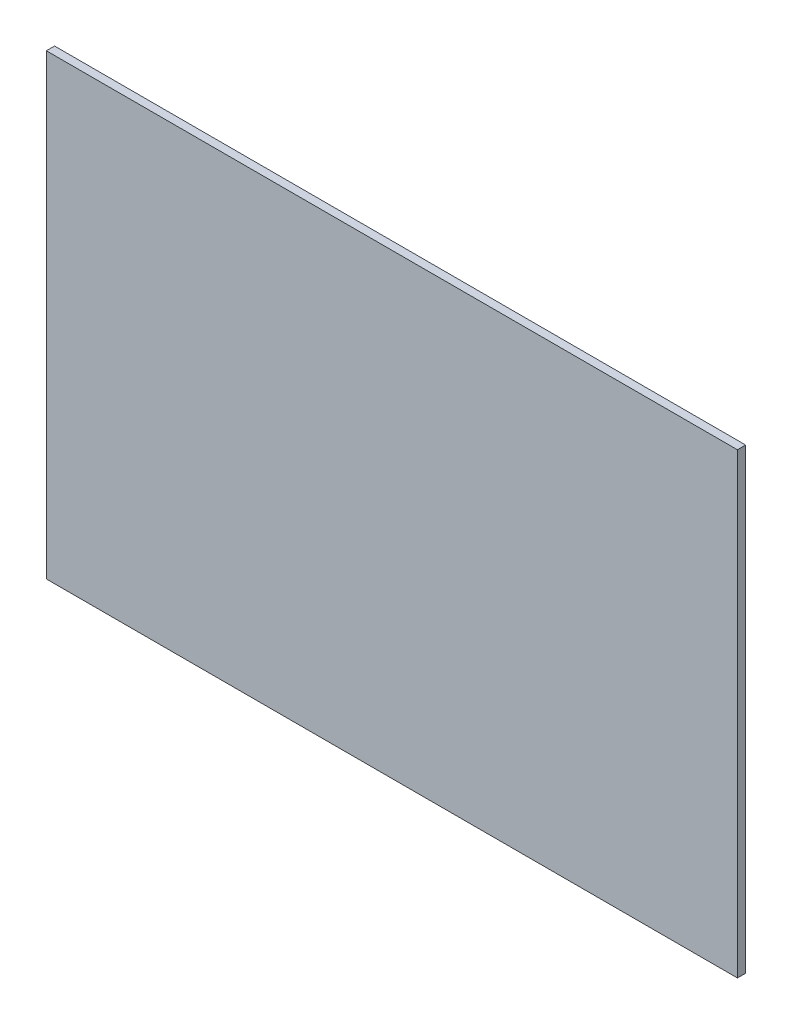
from build123d import *

# Parameters (mm, degrees)
SKETCH_1_W      = 420
SKETCH_1_H      = 278
EXTRUDE_1_DEPTH = 5


with BuildPart() as part:
    # 스케치1 → 보스-돌출1 (new body)
    with BuildSketch(Plane.XY):
        Rectangle(SKETCH_1_W, SKETCH_1_H)
    extrude(amount=EXTRUDE_1_DEPTH)


solid = part.part
